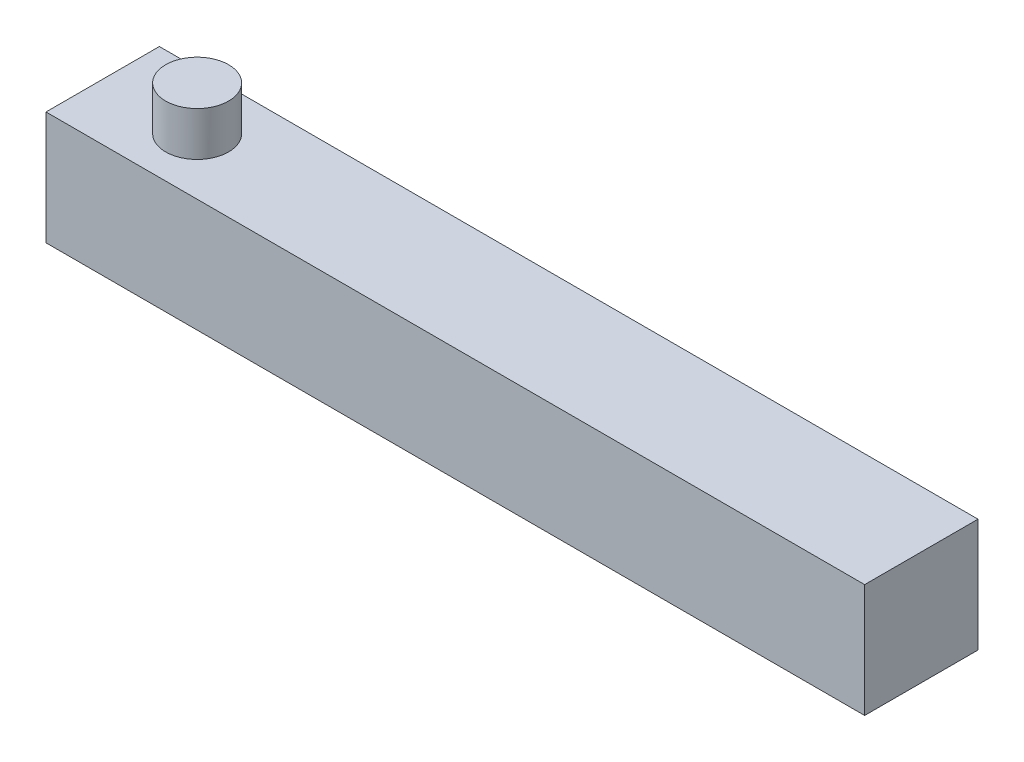
from build123d import *

# Parameters (mm, degrees)
SKETCH_1_W      = 65
SKETCH_1_H      = 9
EXTRUDE_1_DEPTH = 9
SKETCH_2_R      = 2.5
EXTRUDE_2_DEPTH = 3.5
SKETCH_3_R      = 2.5
EXTRUDE_3_DEPTH = 10


with BuildPart() as part:
    # 草圖1 → 擠出1 (new body)
    with BuildSketch(Plane(origin=(0, 0, 0), x_dir=(-1, 0, 0), z_dir=(0, 1, 0))):
        Rectangle(SKETCH_1_W, SKETCH_1_H)
    extrude(amount=EXTRUDE_1_DEPTH)

    # 草圖2 → 擠出2 (add)
    with BuildSketch(Plane(origin=(0, 9, 0), x_dir=(-1, 0, 0), z_dir=(0, 1, 0))):
        with Locations(Location((-25, 0, 0), (0, 0, 270))):
            Circle(SKETCH_2_R)
        with Locations(Location((25, 0, 0), (0, 0, 270))):
            Circle(SKETCH_2_R)
    extrude(amount=EXTRUDE_2_DEPTH)

    # 草圖3 → 擠出3 (cut)
    with BuildSketch(Plane(origin=(0, 9, 0), x_dir=(-1, 0, 0), z_dir=(0, 1, 0))):
        with Locations((-25, 0)):
            Circle(SKETCH_3_R)
    extrude(amount=EXTRUDE_3_DEPTH, mode=Mode.SUBTRACT)


solid = part.part
